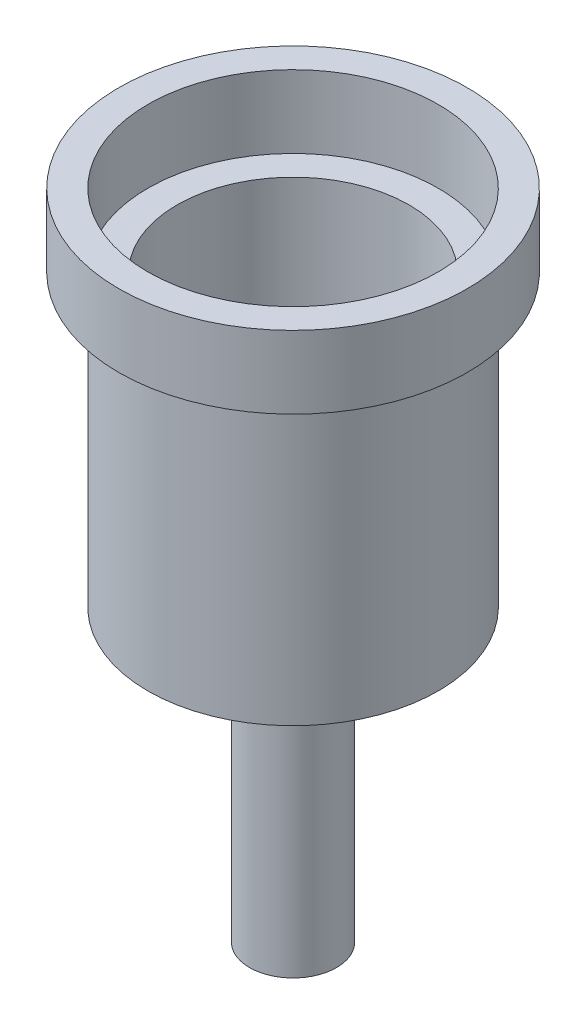
from build123d import *

# Parameters (mm, degrees)
SKETCH1_R           = 1.905
BOSS_EXTRUDE1_DEPTH = 12.7
SKETCH2_R           = 6.35
BOSS_EXTRUDE2_DEPTH = 12.7
SKETCH4_R           = 5.08
CUT_EXTRUDE2_DEPTH  = 10.16
SKETCH5_R           = 1.27
CUT_EXTRUDE3_DEPTH  = 12.7
SKETCH6_W           = 2.54
SKETCH6_H           = 3.81
CUT_EXTRUDE4_DEPTH  = 5.08
SKETCH7_R           = 7.62
SKETCH7_R_2         = 6.35
BOSS_EXTRUDE3_DEPTH = 3.175


with BuildPart() as part:
    # Sketch1 → Boss-Extrude1 (new body)
    with BuildSketch(Plane(origin=(0, 0, 0), x_dir=(1, 0, 0), z_dir=(0, 1, 0))):
        with Locations(Location((0, 0, 0), (0, 0, 270))):
            Circle(SKETCH1_R)
    extrude(amount=BOSS_EXTRUDE1_DEPTH)

    # Sketch2 → Boss-Extrude2 (add)
    with BuildSketch(Plane(origin=(0, 12.7, 0), x_dir=(1, 0, 0), z_dir=(0, 1, 0))):
        with Locations(Location((0, 0, 0), (0, 0, 270))):
            Circle(SKETCH2_R)
    extrude(amount=BOSS_EXTRUDE2_DEPTH)

    # Sketch4 → Cut-Extrude2 (cut)
    with BuildSketch(Plane(origin=(0, 25.4, 0), x_dir=(1, 0, 0), z_dir=(0, 1, 0))):
        with Locations(Location((0, 0, 0), (0, 0, 270))):
            Circle(SKETCH4_R)
    extrude(amount=-CUT_EXTRUDE2_DEPTH, mode=Mode.SUBTRACT)

    # Sketch5 → Cut-Extrude3 (cut)
    with BuildSketch(Plane(origin=(0, 15.24, 0), x_dir=(1, 0, 0), z_dir=(0, 1, 0))):
        with Locations(Location((0, 0, 0), (0, 0, 270))):
            Circle(SKETCH5_R)
    extrude(amount=-CUT_EXTRUDE3_DEPTH, mode=Mode.SUBTRACT)

    # Sketch6 → Cut-Extrude4 (cut)
    with BuildSketch(Plane(origin=(0, 0, 0), x_dir=(0, 0, -1), z_dir=(1, 0, 0))):
        with Locations((0, 4.445)):
            Rectangle(SKETCH6_W, SKETCH6_H)
    extrude(amount=-CUT_EXTRUDE4_DEPTH, mode=Mode.SUBTRACT)


with BuildPart() as body_2:
    # Sketch7 → Boss-Extrude3 (new body)
    with BuildSketch(Plane(origin=(0, 25.4, 0), x_dir=(1, 0, 0), z_dir=(0, 1, 0))):
        with Locations(Location((0, 0, 0), (0, 0, 270))):
            Circle(SKETCH7_R)
        with Locations(Location((0, 0, 0), (0, 0, 270))):
            Circle(SKETCH7_R_2, mode=Mode.SUBTRACT)
    extrude(amount=BOSS_EXTRUDE3_DEPTH)


solid = Compound([part.part, body_2.part])
